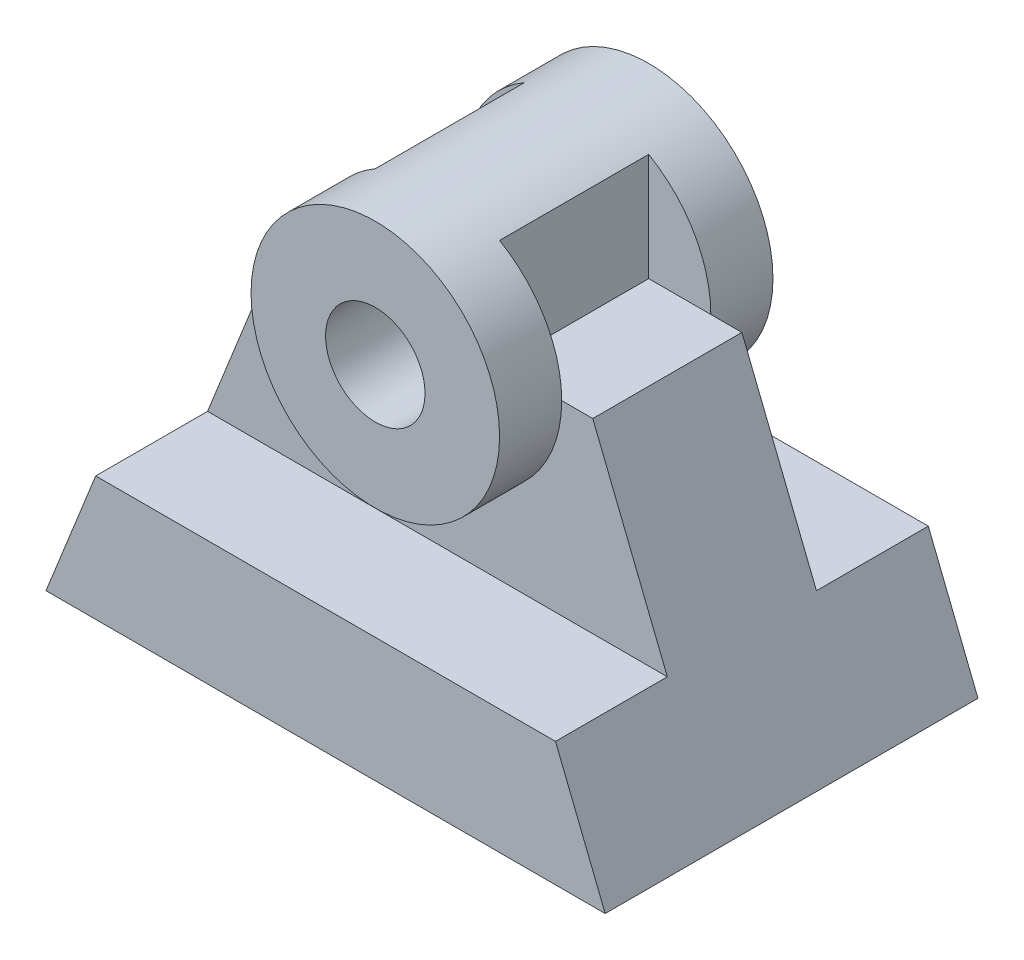
from build123d import *

# Parameters (mm, degrees)
BOSS_EXTRUDE1_DEPTH     = 30
CUT_EXTRUDE1_DEPTH      = 74.654599313
CUT_EXTRUDE1_DEPTH_BACK = 74.654599313
SKETCH3_W               = 18
SKETCH3_H               = 30
SKETCH4_R               = 20
SKETCH4_R_2             = 8
BOSS_EXTRUDE2_DEPTH     = 22
CUT_EXTRUDE2_DEPTH      = 12
CUT_EXTRUDE3_DEPTH      = 94.214805691
CUT_EXTRUDE3_DEPTH_BACK = 94.214805691
SKETCH6_R               = 8


with BuildPart() as part:
    # Sketch1 → Boss-Extrude1 (new, symmetric)
    with BuildSketch(Plane.XY):
        Polygon((-45, 0), (45, 0), (25, 50), (-25, 50), align=None)
    extrude(amount=BOSS_EXTRUDE1_DEPTH, both=True)

    # Sketch3 → Cut-Extrude1 (cut, two sides: drawn at the far end of the back side and taken through both)
    with BuildSketch(Plane(origin=(0, 0, 0), x_dir=(0, 0, -1), z_dir=(1, 0, 0)).offset(-CUT_EXTRUDE1_DEPTH_BACK)):
        with Locations((21, 35)):
            Rectangle(SKETCH3_W, SKETCH3_H)
        with Locations((-21, 35)):
            Rectangle(SKETCH3_W, SKETCH3_H)
    extrude(amount=CUT_EXTRUDE1_DEPTH + CUT_EXTRUDE1_DEPTH_BACK, mode=Mode.SUBTRACT)

    # Sketch4 → Boss-Extrude2 (add, symmetric)
    with BuildSketch(Plane.XY):
        with Locations((0, 50)):
            Circle(SKETCH4_R)
        with Locations((0, 50)):
            Circle(SKETCH4_R_2, mode=Mode.SUBTRACT)
    extrude(amount=BOSS_EXTRUDE2_DEPTH, both=True)

    # Sketch5 → Cut-Extrude2 (cut, symmetric)
    with BuildSketch(Plane.XY):
        with BuildLine():
            Line((-20, 50), (-10, 50))
            Line((-10, 50), (-10, 67.320508076))
            ThreePointArc((-10, 67.320508076), (-17.320508076, 60), (-20, 50))
        make_face()
        with BuildLine():
            Line((10, 50), (10, 67.320508076))
            ThreePointArc((10, 67.320508076), (17.320508076, 60), (20, 50))
            Line((20, 50), (10, 50))
        make_face()
    extrude(amount=CUT_EXTRUDE2_DEPTH, both=True, mode=Mode.SUBTRACT)

    # Sketch6 → Cut-Extrude3 (cut, two sides: drawn at the far end of the back side and taken through both)
    with BuildSketch(Plane.XY.offset(12).offset(-CUT_EXTRUDE3_DEPTH_BACK)):
        with Locations((0, 50)):
            Circle(SKETCH6_R)
    extrude(amount=CUT_EXTRUDE3_DEPTH + CUT_EXTRUDE3_DEPTH_BACK, mode=Mode.SUBTRACT)


solid = part.part
